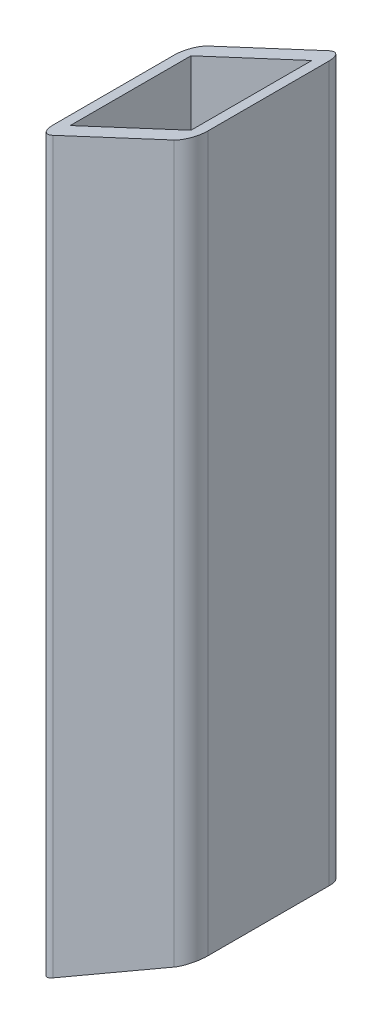
from build123d import *

# Parameters (mm, degrees)
BOSS_EXTRUDE1_DEPTH     = 133
SKETCH3_W               = 20
SKETCH3_H               = 20
CUT_EXTRUDE1_DEPTH      = 1040.5
CUT_EXTRUDE2_DEPTH      = 138.347005792
CUT_EXTRUDE2_DEPTH_BACK = 138.347005792
CUT_EXTRUDE3_DEPTH      = 138.347005792
CUT_EXTRUDE3_DEPTH_BACK = 138.347005792


with BuildPart() as part:
    # Sketch1 → Boss-Extrude1 (new body)
    with BuildSketch(Plane(origin=(0, 0, 0), x_dir=(1, 0, 0), z_dir=(0, 1, 0))):
        with BuildLine():
            Line((2.8, 0), (22.8, 0))
            ThreePointArc((22.8, 0), (24.779898987, -0.820101013), (25.6, -2.8))
            Line((25.6, -2.8), (25.6, -22.8))
            ThreePointArc((25.6, -22.8), (24.779898987, -24.779898987), (22.8, -25.6))
            Line((22.8, -25.6), (2.8, -25.6))
            ThreePointArc((2.8, -25.6), (0.820101013, -24.779898987), (0, -22.8))
            Line((0, -22.8), (0, -2.8))
            ThreePointArc((0, -2.8), (0.820101013, -0.820101013), (2.8, 0))
        make_face()
    extrude(amount=BOSS_EXTRUDE1_DEPTH)

    # Sketch3 → Cut-Extrude1 (cut)
    with BuildSketch(Plane(origin=(0, 0, 0), x_dir=(-1, 0, 0), z_dir=(0, -1, 0))):
        with Locations((-12.8, -12.8)):
            Rectangle(SKETCH3_W, SKETCH3_H)
    extrude(amount=-CUT_EXTRUDE1_DEPTH, mode=Mode.SUBTRACT)

    # Sketch4 → Cut-Extrude2 (cut, two sides: drawn at the far end of the back side and taken through both)
    with BuildSketch(Plane(origin=(0, 0, 22.8), x_dir=(-1, 0, 0), z_dir=(0, 0, -1)).offset(-CUT_EXTRUDE2_DEPTH_BACK)):
        Polygon((-280.166183006, 251.706160643), (-25.6, 133), (0, 121.062523951), (254.566183006, 2.356363308), (491.978504292, 511.48872932), (-42.75386172, 760.838526655), align=None)
    extrude(amount=CUT_EXTRUDE2_DEPTH + CUT_EXTRUDE2_DEPTH_BACK, mode=Mode.SUBTRACT)

    # Sketch5 → Cut-Extrude3 (cut, two sides: drawn at the far end of the back side and taken through both)
    with BuildSketch(Plane(origin=(0, 0, 22.8), x_dir=(-1, 0, 0), z_dir=(0, 0, -1)).offset(-CUT_EXTRUDE3_DEPTH_BACK)):
        Polygon((243.251558225, -140.441352622), (0, 0), (-25.6, 14.780166891), (-268.851558225, 155.221519513), (-549.734263468, -331.281596936), (-37.631147019, -626.944469071), align=None)
    extrude(amount=CUT_EXTRUDE3_DEPTH + CUT_EXTRUDE3_DEPTH_BACK, mode=Mode.SUBTRACT)


solid = part.part
